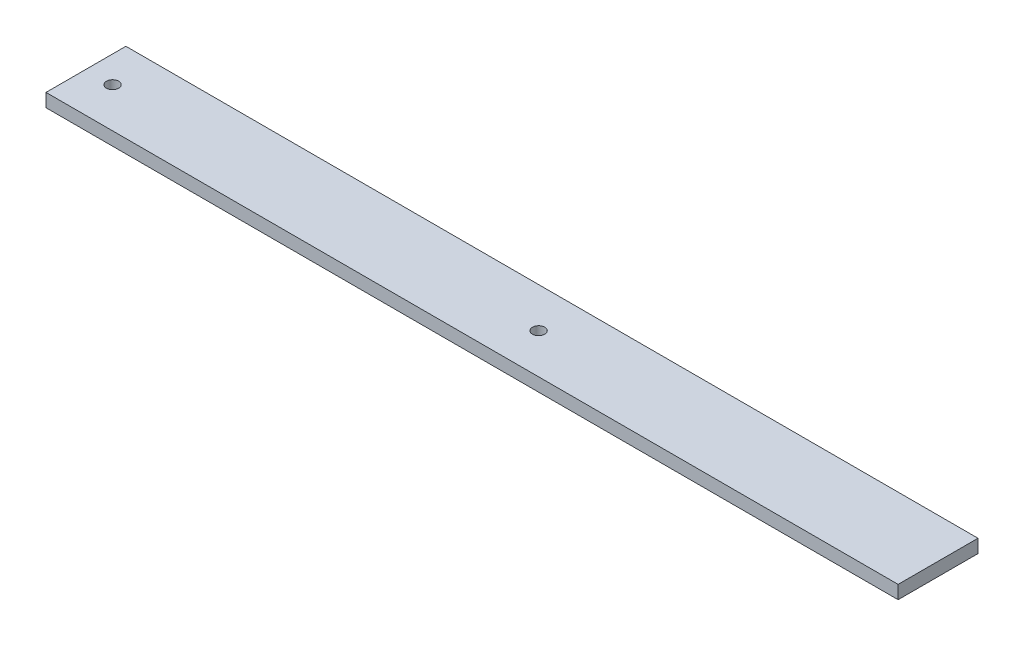
from build123d import *

# Parameters (mm, degrees)
SKETCH1_W           = 203.2
SKETCH1_H           = 19.05
SKETCH1_R           = 1.4605
BOSS_EXTRUDE1_DEPTH = 3.175


with BuildPart() as part:
    # Sketch1 → Boss-Extrude1 (new body)
    with BuildSketch(Plane(origin=(0, 0, 0), x_dir=(1, 0, 0), z_dir=(0, 1, 0))):
        with Locations((101.6, 9.525)):
            Rectangle(SKETCH1_W, SKETCH1_H)
        with Locations(Location((6.35, 9.525, 0), (0, 0, 270))):
            Circle(SKETCH1_R, mode=Mode.SUBTRACT)
        with Locations(Location((107.95, 9.525, 0), (0, 0, 270))):
            Circle(SKETCH1_R, mode=Mode.SUBTRACT)
    extrude(amount=BOSS_EXTRUDE1_DEPTH)


solid = part.part
